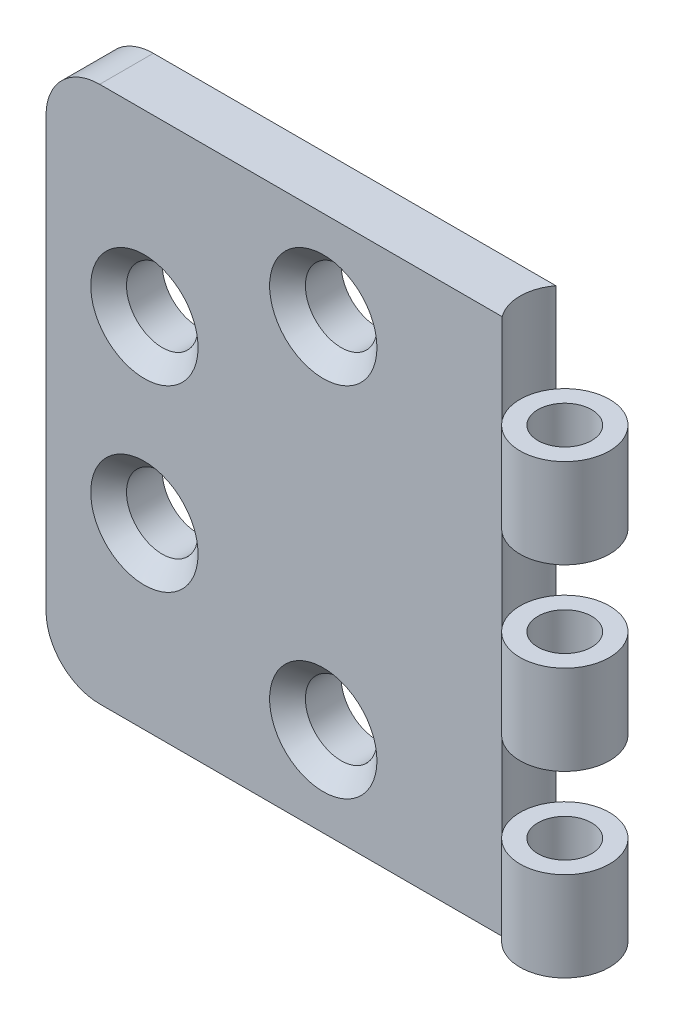
from build123d import *

# Parameters (mm, degrees)
SKETCH_1_W          = 30
SKETCH_1_H          = 30
EXTRUDE_1_DEPTH     = 3
CUT_EXTRUDE_1_DEPTH = 34.674916481
SKETCH_3_R          = 2.5
EXTRUDE_3_DEPTH     = 30
FILLET_1_R          = 3
CUT_EXTRUDE_2_DEPTH = 22.587033145
SKETCH_6_R          = 2.5
CUT_EXTRUDE_3_DEPTH = 5
SKETCH_7_R          = 2.5
CUT_EXTRUDE_4_DEPTH = 5
CUT_EXTRUDE_START   = -5
SKETCH_8_R          = 2.5
CUT_EXTRUDE_5_DEPTH = 5
SKETCH_9_R          = 1.5
CUT_EXTRUDE_6_DEPTH = 34.778691508
CHAMFER_1_SIZE      = 1


with BuildPart() as part:
    # Эскиз1 → Бобышка-Вытянуть1 (new body)
    with BuildSketch(Plane.XY):
        Rectangle(SKETCH_1_W, SKETCH_1_H)
    extrude(amount=EXTRUDE_1_DEPTH)

    # Эскиз2 → Вырез-Вытянуть1 (cut, through all)
    with BuildSketch(Plane.XZ.offset(15)):
        with BuildLine():
            Line((15, 0), (15, 1.5))
            ThreePointArc((15, 1.5), (14.871708245, 0.709430585), (14.5, 0))
            Line((14.5, 0), (15, 0))
        make_face()
        with BuildLine():
            ThreePointArc((14.5, 3), (14.871708245, 2.290569415), (15, 1.5))
            Line((15, 1.5), (15, 3))
            Line((15, 3), (14.5, 3))
        make_face()
    extrude(amount=-CUT_EXTRUDE_1_DEPTH, mode=Mode.SUBTRACT)

    # Эскиз3 → Бобышка-Вытянуть3 (add)
    with BuildSketch(Plane.XZ.offset(15)):
        with Locations((12.5, 1.5)):
            Circle(SKETCH_3_R)
    extrude(amount=-EXTRUDE_3_DEPTH)

    # Скругление1
    fillet_1_edges = [part.edges().sort_by_distance(p)[0] for p in [
        (-15, -15, 1.5),
        (-15, 15, 1.5),
    ]]
    fillet(fillet_1_edges, radius=FILLET_1_R)

    # Эскиз4 → Вырез-Вытянуть2 (cut, through all)
    with BuildSketch(Plane.XY.offset(3)):
        with BuildLine():
            ThreePointArc((-7.5, -5), (-8.085786438, -3.585786438), (-9.5, -3))
            Line((-9.5, -3), (-9.5, -7))
            ThreePointArc((-9.5, -7), (-8.085786438, -6.414213562), (-7.5, -5))
        make_face()
        with BuildLine():
            Line((-9.5, -7), (-9.5, -3))
            ThreePointArc((-9.5, -3), (-11.5, -5), (-9.5, -7))
        make_face()
        with BuildLine():
            ThreePointArc((0.5, -8), (-1.5, -10), (0.5, -12))
            Line((0.5, -12), (0.5, -8))
        make_face()
        with BuildLine():
            Line((0.5, -8), (0.5, -12))
            ThreePointArc((0.5, -12), (1.914213562, -11.414213562), (2.5, -10))
            ThreePointArc((2.5, -10), (1.914213562, -8.585786438), (0.5, -8))
        make_face()
        with BuildLine():
            ThreePointArc((-9.5, 7), (-11.5, 5), (-9.5, 3))
            Line((-9.5, 3), (-9.5, 5))
            Line((-9.5, 5), (-9.5, 7))
        make_face()
        with BuildLine():
            Line((-9.5, 5), (-9.5, 3))
            ThreePointArc((-9.5, 3), (-8.085786438, 3.585786438), (-7.5, 5))
            ThreePointArc((-7.5, 5), (-8.085786438, 6.414213562), (-9.5, 7))
            Line((-9.5, 7), (-9.5, 5))
        make_face()
        with BuildLine():
            ThreePointArc((0.5, 12), (-1.5, 10), (0.5, 8))
            Line((0.5, 8), (0.5, 10))
            Line((0.5, 10), (0.5, 12))
        make_face()
        with BuildLine():
            Line((0.5, 10), (0.5, 8))
            ThreePointArc((0.5, 8), (1.914213562, 8.585786438), (2.5, 10))
            ThreePointArc((2.5, 10), (1.914213562, 11.414213562), (0.5, 12))
            Line((0.5, 12), (0.5, 10))
        make_face()
    extrude(amount=-CUT_EXTRUDE_2_DEPTH, mode=Mode.SUBTRACT)

    # Эскиз6 → Вырез-Вытянуть3 (cut)
    with BuildSketch(Plane(origin=(0, -10, 0), x_dir=(-1, 0, 0), z_dir=(0, -1, 0))):
        with Locations((-12.5, -1.5)):
            Circle(SKETCH_6_R)
    extrude(amount=-CUT_EXTRUDE_3_DEPTH, mode=Mode.SUBTRACT)

    # Эскиз7 → Вырез-Вытянуть4 (cut)
    with BuildSketch(Plane(origin=(0, 0, 0), x_dir=(-1, 0, 0), z_dir=(0, -1, 0))):
        with Locations((-12.5, -1.5)):
            Circle(SKETCH_7_R)
    extrude(amount=-CUT_EXTRUDE_4_DEPTH, mode=Mode.SUBTRACT)

    # Эскиз8 → Вырез-Вытянуть5 (cut)
    with BuildSketch(Plane(origin=(0, 15, 0), x_dir=(1, 0, 0), z_dir=(0, 1, 0)).offset(CUT_EXTRUDE_START)):
        with Locations((12.5, -1.5)):
            Circle(SKETCH_8_R)
    extrude(amount=CUT_EXTRUDE_5_DEPTH, mode=Mode.SUBTRACT)

    # Эскиз9 → Вырез-Вытянуть6 (cut, through all)
    with BuildSketch(Plane.XZ.offset(15)):
        with Locations(Location((12.5, 1.5, 0), (0, 0, 270))):
            Circle(SKETCH_9_R)
    extrude(amount=-CUT_EXTRUDE_6_DEPTH, mode=Mode.SUBTRACT)

    # Фаска1
    chamfer_1_edges = [part.edges().sort_by_distance(p)[0] for p in [
        (-9.5, -3, 3),
        (0.5, -8, 3),
        (-9.5, 3, 3),
        (0.5, 8, 3),
    ]]
    chamfer(chamfer_1_edges, length=CHAMFER_1_SIZE)


solid = part.part
